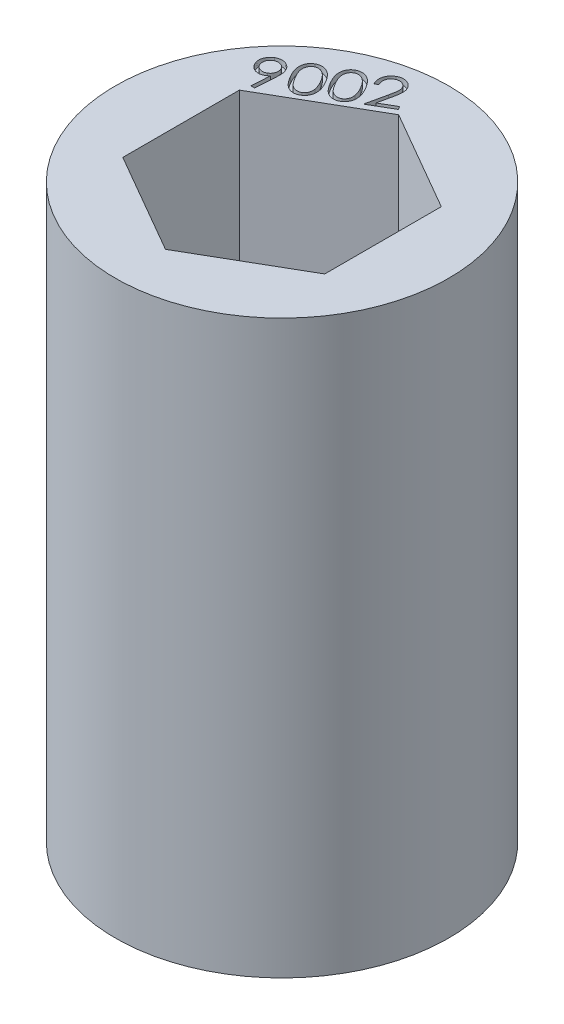
from build123d import *

# Parameters (mm, degrees)
SKETCH1_R           = 11.1125
BOSS_EXTRUDE1_DEPTH = 38.1
CUT_EXTRUDE2_DEPTH  = 0.399999962


with BuildPart() as part:
    # Sketch1 → Boss-Extrude1 (new body)
    with BuildSketch(Plane(origin=(0, 0, 0), x_dir=(1, 0, 0), z_dir=(0, 1, 0))):
        with Locations(Location((0, 0, 0), (0, 0, 90))):
            Circle(SKETCH1_R)
        Polygon((0, 7.772289324), (-6.731, 3.886144662), (-6.731, -3.886144662), (0, -7.772289324), (6.731, -3.886144662), (6.731, 3.886144662), align=None, mode=Mode.SUBTRACT)
    extrude(amount=BOSS_EXTRUDE1_DEPTH)

    # Sketch2 → Cut-Extrude2 (cut)
    # profile 1 of 4: a face of its own
    with BuildSketch(Plane(origin=(0, 38.1, 0), x_dir=(1, 0, 0), z_dir=(0, 1, 0))):
        with BuildLine():
            Line((-6.341689912, 4.509607129), (-6.587447124, 4.520801039))
            Line((-6.587447124, 4.520801039), (-6.519266034, 5.752639982))
            add(Edge.make_bspline(
                [(-6.519266034, 5.752639982), (-6.535115984, 5.735418518), (-6.566015902, 5.701844794), (-6.615639899, 5.657045179), (-6.666054362, 5.61785451), (-6.701391585, 5.595971632), (-6.718721162, 5.585240142)],
                knots=[0, 0, 0, 0, 1.073776942, 2.093358062, 3.064971809, 4, 4, 4, 4], degree=3))
            add(Edge.make_bspline(
                [(-6.718721162, 5.585240142), (-6.740190353, 5.573375298), (-6.782465877, 5.550011934), (-6.849189276, 5.524057141), (-6.916211032, 5.503507865), (-6.98455062, 5.491340301), (-7.053965627, 5.487051616), (-7.124226627, 5.488748908), (-7.195424017, 5.498841339), (-7.266610463, 5.515508184), (-7.336358091, 5.538646903), (-7.402880333, 5.56822068), (-7.465126672, 5.604075006), (-7.523767084, 5.645573763), (-7.578135257, 5.693370767), (-7.628024349, 5.747463271), (-7.675155997, 5.806387374), (-7.701545969, 5.850007485), (-7.714979175, 5.872211296)],
                knots=[0, 0, 0, 0, 1.018133992, 2.004833355, 2.968050456, 3.927392872, 4.880867695, 5.853780567, 6.84244091, 7.862937872, 8.888047547, 9.891218825, 10.882437675, 11.867953537, 12.871644484, 13.88381012, 14.922802359, 16, 16, 16, 16], degree=3))
            add(Edge.make_bspline(
                [(-7.714979175, 5.872211296), (-7.73179642, 5.903352756), (-7.764871178, 5.96459919), (-7.798825331, 6.062258045), (-7.819425921, 6.161302762), (-7.826724862, 6.261443281), (-7.819918124, 6.36137828), (-7.800161746, 6.459919196), (-7.765816335, 6.555877108), (-7.719298363, 6.648398425), (-7.661210331, 6.735125396), (-7.592213175, 6.812993215), (-7.514393665, 6.882230505), (-7.455548697, 6.919124714), (-7.425972765, 6.937668027)],
                knots=[0, 0, 0, 0, 1.034877314, 2.035310589, 3.01406532, 3.989830017, 4.965253495, 5.938145702, 6.922878307, 7.939982544, 8.963286446, 9.969507557, 10.979458936, 12, 12, 12, 12], degree=3))
            add(Edge.make_bspline(
                [(-7.425972765, 6.937668027), (-7.395827361, 6.953777535), (-7.336168034, 6.985659093), (-7.240564481, 7.018366694), (-7.142339109, 7.039367637), (-7.042033508, 7.045951785), (-6.941713756, 7.04093449), (-6.843655248, 7.021144442), (-6.748650534, 6.988498335), (-6.658511171, 6.941881882), (-6.574489532, 6.884741248), (-6.498494408, 6.818216289), (-6.431784176, 6.74236602), (-6.395906772, 6.685484801), (-6.377815714, 6.656802642)],
                knots=[0, 0, 0, 0, 1.017484842, 2.013655614, 3.000286277, 4.003858304, 5.0014266, 5.986034307, 6.975769135, 7.986511211, 9.001795403, 9.997748037, 10.990371328, 12, 12, 12, 12], degree=3))
            add(Edge.make_bspline(
                [(-6.377815714, 6.656802642), (-6.365338732, 6.633609029), (-6.34002248, 6.58654834), (-6.309500106, 6.510518519), (-6.285458846, 6.428987984), (-6.269672772, 6.357169089), (-6.260306184, 6.296014382), (-6.254813982, 6.246272579), (-6.250746715, 6.193155808), (-6.248317285, 6.136650094), (-6.247112881, 6.076583143), (-6.248603321, 6.012975839), (-6.250184504, 5.945940506), (-6.253160652, 5.900188773), (-6.254682701, 5.876790623)],
                knots=[0, 0, 0, 0, 1.182164166, 2.398654368, 3.671095493, 4.996362854, 5.697697926, 6.448887013, 7.243432771, 8.089817077, 8.988794623, 9.941086459, 10.947039495, 12, 12, 12, 12], degree=3))
            Line((-6.254682701, 5.876790623), (-6.341689912, 4.509607129))
        make_face()
        with BuildLine():
            add(Edge.make_bspline(
                [(-6.779270041, 5.805047834), (-6.763794125, 5.81457527), (-6.733396942, 5.833288685), (-6.692006128, 5.866308845), (-6.654677253, 5.90203708), (-6.621172415, 5.940777326), (-6.592941125, 5.983297575), (-6.56806583, 6.028437665), (-6.54791559, 6.076957987), (-6.531606211, 6.12780288), (-6.520757071, 6.180030786), (-6.51373588, 6.23205677), (-6.512647873, 6.283620134), (-6.517623724, 6.334333899), (-6.52637687, 6.384439016), (-6.541618974, 6.433553997), (-6.561328944, 6.482214399), (-6.578312042, 6.513300607), (-6.58693831, 6.529090302)],
                knots=[0, 0, 0, 0, 1.045838798, 2.054195393, 3.042095994, 4.01892461, 4.996924602, 5.976045845, 6.982887395, 8.017767017, 9.046543829, 10.050918556, 11.037659536, 12.008659212, 12.981916231, 13.961475876, 14.964567361, 16, 16, 16, 16], degree=3))
            add(Edge.make_bspline(
                [(-6.58693831, 6.529090302), (-6.596334814, 6.54436384), (-6.614854659, 6.574466904), (-6.646982549, 6.61599525), (-6.683104965, 6.652657042), (-6.721564137, 6.686035178), (-6.763748711, 6.714511996), (-6.808694795, 6.739375257), (-6.85744594, 6.758793889), (-6.908156642, 6.775223598), (-6.960353771, 6.786231316), (-7.012469726, 6.79248455), (-7.064106322, 6.793467553), (-7.115139239, 6.789605745), (-7.165396456, 6.779664), (-7.214919305, 6.764739879), (-7.264110959, 6.745172462), (-7.295216791, 6.727721738), (-7.310980778, 6.718877962)],
                knots=[0, 0, 0, 0, 1.032722608, 2.035423229, 3.016659327, 3.993848871, 4.964125467, 5.943608486, 6.947070603, 7.982332603, 9.011489537, 10.015046801, 11.002152371, 11.982414923, 12.957844117, 13.947123666, 14.959631925, 16, 16, 16, 16], degree=3))
            add(Edge.make_bspline(
                [(-7.310980778, 6.718877962), (-7.326257831, 6.709484312), (-7.356367822, 6.690970091), (-7.397845726, 6.65880125), (-7.434615143, 6.622906892), (-7.467307907, 6.583909991), (-7.496507989, 6.542261904), (-7.5212267, 6.497091614), (-7.54068409, 6.448377059), (-7.557157435, 6.397664161), (-7.567956217, 6.345417855), (-7.574994486, 6.293395482), (-7.576063639, 6.241835461), (-7.571145535, 6.191105122), (-7.562188174, 6.141110667), (-7.547772325, 6.091801068), (-7.527858015, 6.043251572), (-7.510905575, 6.012156257), (-7.50229488, 5.996361937)],
                knots=[0, 0, 0, 0, 1.035054365, 2.040018956, 3.023470561, 3.996529503, 4.97455344, 5.956248008, 6.961975815, 7.999575305, 9.031055945, 10.038070368, 11.027404697, 12.000956352, 12.976771283, 13.956118232, 14.96184604, 16, 16, 16, 16], degree=3))
            add(Edge.make_bspline(
                [(-7.50229488, 5.996361937), (-7.492937473, 5.981056401), (-7.474440062, 5.950800926), (-7.441669883, 5.909660495), (-7.405844485, 5.87270442), (-7.366810186, 5.840041017), (-7.325172138, 5.810833052), (-7.27999913, 5.786116475), (-7.231285328, 5.766658495), (-7.18057222, 5.750185315), (-7.12832597, 5.739386488), (-7.076303583, 5.732348231), (-7.024743566, 5.731279075), (-6.974013226, 5.73619718), (-6.924018771, 5.745154541), (-6.874709172, 5.75957039), (-6.826159676, 5.779484699), (-6.795064361, 5.796437139), (-6.779270041, 5.805047834)],
                knots=[0, 0, 0, 0, 1.03466364, 2.045288747, 3.028369106, 4.001060725, 4.978715465, 5.960039451, 6.965387603, 8.002595407, 9.03368667, 10.040320953, 11.029281816, 12.002465962, 12.97791253, 13.956889783, 14.962237935, 16, 16, 16, 16], degree=3))
        make_face(mode=Mode.SUBTRACT)
    # profile 2 of 4: a face of its own
    with BuildSketch(Plane(origin=(0, 38.1, 0), x_dir=(1, 0, 0), z_dir=(0, 1, 0))):
        with BuildLine():
            add(Edge.make_bspline(
                [(-5.799020566, 6.345917225), (-5.819137188, 6.380876373), (-5.858250299, 6.448848075), (-5.910645372, 6.550183286), (-5.958270431, 6.646218542), (-5.997603154, 6.73878403), (-6.032157009, 6.826197983), (-6.059159785, 6.90972027), (-6.080370238, 6.988434421), (-6.09483277, 7.063459777), (-6.103224739, 7.135088312), (-6.108137585, 7.204202044), (-6.1081872, 7.271196242), (-6.103533868, 7.335949783), (-6.094971925, 7.398561652), (-6.081845729, 7.459001216), (-6.063923561, 7.517358806), (-6.041547615, 7.573315564), (-6.014996094, 7.62653638), (-5.985540414, 7.677225821), (-5.952343061, 7.724702408), (-5.915561443, 7.769078364), (-5.875441839, 7.810512438), (-5.831180746, 7.847970666), (-5.784503006, 7.883596572), (-5.750875737, 7.904190292), (-5.733892361, 7.914591103)],
                knots=[0, 0, 0, 0, 1.644034348, 3.196525615, 4.649901988, 6.012627005, 7.295351775, 8.480442992, 9.588999708, 10.616866424, 11.591961896, 12.527448117, 13.440119844, 14.320422827, 15.172102722, 16.014299769, 16.838828387, 17.657976332, 18.468116412, 19.261441334, 20.045949409, 20.826762069, 21.609073322, 22.393520457, 23.188651129, 24, 24, 24, 24], degree=3))
            add(Edge.make_bspline(
                [(-5.733892361, 7.914591103), (-5.716221156, 7.924356924), (-5.681331282, 7.943638475), (-5.626905383, 7.967719936), (-5.571557767, 7.986946895), (-5.515116783, 8.001928534), (-5.457744686, 8.012051554), (-5.399387254, 8.017477212), (-5.340196324, 8.01933531), (-5.280155523, 8.015462259), (-5.219553032, 8.007503263), (-5.158810677, 7.994154833), (-5.09798996, 7.97559266), (-5.03713486, 7.952453118), (-4.976688223, 7.923363283), (-4.91594775, 7.889951375), (-4.855701501, 7.850401155), (-4.794632702, 7.806660557), (-4.733837412, 7.756480417), (-4.673265298, 7.699437505), (-4.613268743, 7.634781163), (-4.552845555, 7.563770705), (-4.492561335, 7.485495767), (-4.43292518, 7.39997821), (-4.372590227, 7.307821859), (-4.334073595, 7.243105717), (-4.314301014, 7.209883571)],
                knots=[0, 0, 0, 0, 0.817377658, 1.613823418, 2.406706973, 3.188082347, 3.976310968, 4.762981823, 5.560019736, 6.371953555, 7.196686324, 8.033346022, 8.887307745, 9.77003846, 10.667188984, 11.601865034, 12.575431866, 13.583918072, 14.64279311, 15.765256261, 16.950981143, 18.213051169, 19.540207999, 20.950354672, 22.434459175, 24, 24, 24, 24], degree=3))
            add(Edge.make_bspline(
                [(-4.314301014, 7.209883571), (-4.295240754, 7.176430329), (-4.258115995, 7.111271539), (-4.20779242, 7.013981382), (-4.163215626, 6.920249083), (-4.12504704, 6.829747275), (-4.092800298, 6.742694247), (-4.066717504, 6.65915919), (-4.046521515, 6.579017953), (-4.032944904, 6.501940275), (-4.023967393, 6.427876916), (-4.020657471, 6.356302246), (-4.020895335, 6.287145494), (-4.025890541, 6.220294167), (-4.035811943, 6.155930538), (-4.049080998, 6.09363262), (-4.068390976, 6.033966568), (-4.090982838, 5.97650783), (-4.118087988, 5.9219881), (-4.148741033, 5.870601774), (-4.182167952, 5.821983409), (-4.219639316, 5.777039562), (-4.260442582, 5.735150854), (-4.304913833, 5.696453866), (-4.352565061, 5.660645638), (-4.386708692, 5.639915582), (-4.403852296, 5.629506969)],
                knots=[0, 0, 0, 0, 1.560702367, 3.039869158, 4.439270698, 5.7673313, 7.020315304, 8.201179658, 9.313456641, 10.3681399, 11.371931529, 12.335719086, 13.27082701, 14.174152084, 15.05027287, 15.909393739, 16.753106729, 17.589390937, 18.410385714, 19.218115999, 20.013460668, 20.799598541, 21.58726835, 22.381542408, 23.187368323, 24, 24, 24, 24], degree=3))
            add(Edge.make_bspline(
                [(-4.403852296, 5.629506969), (-4.421197894, 5.61994198), (-4.455632749, 5.600953358), (-4.509062761, 5.576856375), (-4.563881229, 5.558206471), (-4.619247185, 5.543298766), (-4.675575106, 5.533010121), (-4.732760111, 5.527647227), (-4.79093337, 5.525783332), (-4.849795318, 5.529622383), (-4.909042093, 5.537625724), (-4.968110356, 5.550904189), (-5.02707859, 5.569494998), (-5.085846855, 5.592929053), (-5.144636451, 5.620895813), (-5.202865421, 5.654464224), (-5.261334613, 5.692411861), (-5.3196715, 5.736223003), (-5.378881117, 5.785535862), (-5.436931924, 5.843759384), (-5.496735751, 5.908126784), (-5.55625515, 5.981010775), (-5.616469619, 6.061268538), (-5.677860438, 6.148878777), (-5.738514045, 6.244756675), (-5.778475934, 6.311568758), (-5.799020566, 6.345917225)],
                knots=[0, 0, 0, 0, 0.808350198, 1.604754265, 2.388541232, 3.169387609, 3.943391085, 4.722486235, 5.51196978, 6.31648673, 7.127145912, 7.950126741, 8.784357439, 9.64825073, 10.530750472, 11.439234062, 12.389715372, 13.374155297, 14.415677566, 15.531832443, 16.727270725, 18.001027435, 19.370379368, 20.822274555, 22.366313522, 24, 24, 24, 24], degree=3))
        make_face()
        with BuildLine():
            add(Edge.make_bspline(
                [(-5.590915598, 6.460909212), (-5.573440634, 6.431298356), (-5.53953556, 6.373847122), (-5.487666865, 6.292139709), (-5.437286703, 6.217016794), (-5.387973694, 6.148734993), (-5.339827588, 6.08723638), (-5.292924494, 6.032446399), (-5.247358097, 5.984576074), (-5.202443283, 5.943145077), (-5.157859735, 5.907401491), (-5.113553727, 5.87575857), (-5.069068725, 5.847810351), (-5.023729969, 5.824710335), (-4.97850677, 5.804609898), (-4.932924943, 5.788698585), (-4.886969778, 5.776899606), (-4.82624751, 5.767039846), (-4.751910517, 5.763271467), (-4.665874847, 5.770999897), (-4.584541831, 5.792505443), (-4.535589993, 5.817861348), (-4.511212072, 5.830488539)],
                knots=[0, 0, 0, 0, 1.476356606, 2.864439632, 4.155202907, 5.359990145, 6.480395206, 7.508129809, 8.455932756, 9.316718945, 10.129977133, 10.908036151, 11.653792312, 12.383442324, 13.091134884, 13.777520252, 14.454059297, 15.125759256, 16.416522531, 17.638359492, 18.823907595, 20, 20, 20, 20], degree=3))
            add(Edge.make_bspline(
                [(-4.511212072, 5.830488539), (-4.488051977, 5.845478927), (-4.441783285, 5.875426368), (-4.382777342, 5.934837304), (-4.333688863, 6.004546303), (-4.30073706, 6.069896442), (-4.280110792, 6.126546004), (-4.267591542, 6.17157471), (-4.259896562, 6.218677856), (-4.254405582, 6.267421904), (-4.253904252, 6.318121821), (-4.25561818, 6.370655638), (-4.261919155, 6.425205022), (-4.26863577, 6.461962018), (-4.272069444, 6.480752962)],
                knots=[0, 0, 0, 0, 1.33630058, 2.669629766, 4.033624605, 5.462390011, 6.207376901, 6.958436539, 7.727338561, 8.522083004, 9.337418894, 10.186163895, 11.072729092, 12, 12, 12, 12], degree=3))
            add(Edge.make_bspline(
                [(-4.272069444, 6.480752962), (-4.276870691, 6.504395205), (-4.286611403, 6.5523603), (-4.306927248, 6.624450766), (-4.331407794, 6.697823803), (-4.359474677, 6.773123359), (-4.391913794, 6.849762377), (-4.429392413, 6.9276101), (-4.470497395, 7.007098846), (-4.500513443, 7.059883529), (-4.515791399, 7.086750559)],
                knots=[0, 0, 0, 0, 0.882068512, 1.78952996, 2.736964178, 3.71053707, 4.727846161, 5.779394579, 6.869727589, 8, 8, 8, 8], degree=3))
            add(Edge.make_bspline(
                [(-4.515791399, 7.086750559), (-4.531554558, 7.113487619), (-4.562275809, 7.165596203), (-4.610362965, 7.240239331), (-4.658679725, 7.309596198), (-4.70614773, 7.374656176), (-4.754924033, 7.433619732), (-4.802978179, 7.488399587), (-4.851852419, 7.537533498), (-4.900339488, 7.582106792), (-4.948482067, 7.621828588), (-4.996711284, 7.656627806), (-5.044356593, 7.687202722), (-5.09186172, 7.713415112), (-5.139169878, 7.734852714), (-5.186350501, 7.751668017), (-5.233014175, 7.764791953), (-5.29405867, 7.774373361), (-5.367840868, 7.778318559), (-5.453084073, 7.770594531), (-5.533390072, 7.748848128), (-5.58195205, 7.723980794), (-5.606180021, 7.711574277)],
                knots=[0, 0, 0, 0, 1.332504437, 2.596954185, 3.810955169, 4.961515238, 6.053335941, 7.095281101, 8.089064306, 9.027099332, 9.922178341, 10.767001951, 11.579054004, 12.351414003, 13.094486943, 13.806213877, 14.500440979, 15.172034041, 16.45531947, 17.662465411, 18.83378471, 20, 20, 20, 20], degree=3))
            add(Edge.make_bspline(
                [(-5.606180021, 7.711574277), (-5.629318361, 7.696385519), (-5.675462065, 7.666095294), (-5.734941089, 7.606503149), (-5.784157605, 7.535941266), (-5.817658757, 7.469865968), (-5.838380991, 7.412468235), (-5.850477095, 7.366799618), (-5.859899509, 7.319605593), (-5.864728874, 7.270545471), (-5.866323846, 7.21987883), (-5.863977204, 7.167391657), (-5.85917225, 7.112959508), (-5.849770369, 7.056348029), (-5.835782259, 6.996712635), (-5.816777154, 6.933234667), (-5.792901384, 6.865141236), (-5.762269328, 6.793280489), (-5.728030741, 6.716003433), (-5.686839449, 6.634939163), (-5.64131469, 6.54894579), (-5.608047455, 6.490834951), (-5.590915598, 6.460909212)],
                knots=[0, 0, 0, 0, 1.185397667, 2.363982905, 3.585758524, 4.864978775, 5.530346258, 6.201263852, 6.890717709, 7.593225447, 8.314118558, 9.064359639, 9.846542981, 10.657816113, 11.524680262, 12.473501023, 13.500195167, 14.619390862, 15.824731198, 17.126732327, 18.520333571, 20, 20, 20, 20], degree=3))
        make_face(mode=Mode.SUBTRACT)
    # profile 3 of 4: a face of its own
    with BuildSketch(Plane(origin=(0, 38.1, 0), x_dir=(1, 0, 0), z_dir=(0, 1, 0))):
        with BuildLine():
            add(Edge.make_bspline(
                [(-4.106940161, 7.322840302), (-4.127056784, 7.35779945), (-4.166169895, 7.425771152), (-4.218564967, 7.527106363), (-4.266190027, 7.623141619), (-4.30552275, 7.715707107), (-4.340076604, 7.80312106), (-4.36707938, 7.886643347), (-4.388289834, 7.965357498), (-4.402752365, 8.040382854), (-4.411144335, 8.112011389), (-4.416057181, 8.181125121), (-4.416106796, 8.248119319), (-4.411453463, 8.312872859), (-4.40289152, 8.375484729), (-4.389765325, 8.435924293), (-4.371843156, 8.494281883), (-4.34946721, 8.550238641), (-4.32291569, 8.603459457), (-4.29346001, 8.654148898), (-4.260262657, 8.701625485), (-4.223481038, 8.746001441), (-4.183361435, 8.787435515), (-4.139100342, 8.824893743), (-4.092422601, 8.860519649), (-4.058795333, 8.881113369), (-4.041811956, 8.89151418)],
                knots=[0, 0, 0, 0, 1.644034348, 3.196525615, 4.649901988, 6.012627005, 7.295351775, 8.480442992, 9.588999708, 10.616866424, 11.591961896, 12.527448117, 13.440119844, 14.320422827, 15.172102722, 16.014299769, 16.838828387, 17.657976332, 18.468116412, 19.261441334, 20.045949409, 20.826762069, 21.609073322, 22.393520457, 23.188651129, 24, 24, 24, 24], degree=3))
            add(Edge.make_bspline(
                [(-4.041811956, 8.89151418), (-4.024140752, 8.901280001), (-3.989250878, 8.920561552), (-3.934824978, 8.944643013), (-3.879477363, 8.963869972), (-3.823036378, 8.978851611), (-3.765664282, 8.988974631), (-3.70730685, 8.994400289), (-3.64811592, 8.996258387), (-3.588075119, 8.992385335), (-3.527472628, 8.98442634), (-3.466730273, 8.97107791), (-3.405909555, 8.952515737), (-3.345054456, 8.929376195), (-3.284607819, 8.90028636), (-3.223867345, 8.866874452), (-3.163621097, 8.827324232), (-3.102552297, 8.783583634), (-3.041757008, 8.733403494), (-2.981184893, 8.676360582), (-2.921188339, 8.61170424), (-2.860765151, 8.540693782), (-2.800480931, 8.462418844), (-2.740844776, 8.376901287), (-2.680509823, 8.284744936), (-2.641993191, 8.220028794), (-2.62222061, 8.186806648)],
                knots=[0, 0, 0, 0, 0.817377658, 1.613823418, 2.406706973, 3.188082347, 3.976310968, 4.762981823, 5.560019736, 6.371953555, 7.196686324, 8.033346022, 8.887307745, 9.77003846, 10.667188984, 11.601865034, 12.575431866, 13.583918072, 14.64279311, 15.765256261, 16.950981143, 18.213051169, 19.540207999, 20.950354672, 22.434459175, 24, 24, 24, 24], degree=3))
            add(Edge.make_bspline(
                [(-2.62222061, 8.186806648), (-2.603160349, 8.153353406), (-2.56603559, 8.088194616), (-2.515712016, 7.990904459), (-2.471135222, 7.89717216), (-2.432966636, 7.806670352), (-2.400719893, 7.719617324), (-2.374637099, 7.636082267), (-2.354441111, 7.55594103), (-2.3408645, 7.478863352), (-2.331886989, 7.404799993), (-2.328577067, 7.333225323), (-2.32881493, 7.264068571), (-2.333810136, 7.197217244), (-2.343731539, 7.132853615), (-2.357000594, 7.070555697), (-2.376310571, 7.010889645), (-2.398902433, 6.953430907), (-2.426007584, 6.898911177), (-2.456660628, 6.847524851), (-2.490087548, 6.798906486), (-2.527558911, 6.753962639), (-2.568362177, 6.71207393), (-2.612833429, 6.673376942), (-2.660484657, 6.637568715), (-2.694628288, 6.616838659), (-2.711771892, 6.606430046)],
                knots=[0, 0, 0, 0, 1.560702367, 3.039869158, 4.439270698, 5.7673313, 7.020315304, 8.201179658, 9.313456641, 10.3681399, 11.371931529, 12.335719086, 13.27082701, 14.174152084, 15.05027287, 15.909393739, 16.753106729, 17.589390937, 18.410385714, 19.218115999, 20.013460668, 20.799598541, 21.58726835, 22.381542408, 23.187368323, 24, 24, 24, 24], degree=3))
            add(Edge.make_bspline(
                [(-2.711771892, 6.606430046), (-2.72911749, 6.596865057), (-2.763552344, 6.577876435), (-2.816982357, 6.553779452), (-2.871800825, 6.535129548), (-2.927166781, 6.520221843), (-2.983494701, 6.509933198), (-3.040679707, 6.504570304), (-3.098852965, 6.502706409), (-3.157714914, 6.50654546), (-3.216961689, 6.514548801), (-3.276029951, 6.527827266), (-3.334998186, 6.546418074), (-3.39376645, 6.569852129), (-3.452556046, 6.59781889), (-3.510785017, 6.631387301), (-3.569254208, 6.669334938), (-3.627591096, 6.71314608), (-3.686800712, 6.762458939), (-3.74485152, 6.820682461), (-3.804655347, 6.885049861), (-3.864174746, 6.957933852), (-3.924389214, 7.038191615), (-3.985780033, 7.125801854), (-4.046433641, 7.221679752), (-4.08639553, 7.288491835), (-4.106940161, 7.322840302)],
                knots=[0, 0, 0, 0, 0.808350198, 1.604754265, 2.388541232, 3.169387609, 3.943391085, 4.722486235, 5.51196978, 6.31648673, 7.127145912, 7.950126741, 8.784357439, 9.64825073, 10.530750472, 11.439234062, 12.389715372, 13.374155297, 14.415677566, 15.531832443, 16.727270725, 18.001027435, 19.370379368, 20.822274555, 22.366313522, 24, 24, 24, 24], degree=3))
        make_face()
        with BuildLine():
            add(Edge.make_bspline(
                [(-3.898835193, 7.437832289), (-3.88136023, 7.408221433), (-3.847455156, 7.350770199), (-3.795586461, 7.269062786), (-3.745206299, 7.193939871), (-3.69589329, 7.125658069), (-3.647747184, 7.064159457), (-3.60084409, 7.009369476), (-3.555277693, 6.961499151), (-3.510362879, 6.920068154), (-3.465779331, 6.884324568), (-3.421473322, 6.852681647), (-3.37698832, 6.824733428), (-3.331649565, 6.801633412), (-3.286426366, 6.781532974), (-3.240844539, 6.765621662), (-3.194889374, 6.753822683), (-3.134167106, 6.743962923), (-3.059830112, 6.740194544), (-2.973794442, 6.747922974), (-2.892461427, 6.76942852), (-2.843509589, 6.794784425), (-2.819131668, 6.807411616)],
                knots=[0, 0, 0, 0, 1.476356606, 2.864439632, 4.155202907, 5.359990145, 6.480395206, 7.508129809, 8.455932756, 9.316718945, 10.129977133, 10.908036151, 11.653792312, 12.383442324, 13.091134884, 13.777520252, 14.454059297, 15.125759256, 16.416522531, 17.638359492, 18.823907595, 20, 20, 20, 20], degree=3))
            add(Edge.make_bspline(
                [(-2.819131668, 6.807411616), (-2.795971572, 6.822402003), (-2.74970288, 6.852349445), (-2.690696938, 6.911760381), (-2.641608458, 6.98146938), (-2.608656656, 7.046819519), (-2.588030388, 7.10346908), (-2.575511138, 7.148497787), (-2.567816158, 7.195600933), (-2.562325177, 7.244344981), (-2.561823847, 7.295044898), (-2.563537776, 7.347578715), (-2.569838751, 7.402128099), (-2.576555366, 7.438885095), (-2.57998904, 7.457676039)],
                knots=[0, 0, 0, 0, 1.33630058, 2.669629766, 4.033624605, 5.462390011, 6.207376901, 6.958436539, 7.727338561, 8.522083004, 9.337418894, 10.186163895, 11.072729092, 12, 12, 12, 12], degree=3))
            add(Edge.make_bspline(
                [(-2.57998904, 7.457676039), (-2.584790287, 7.481318281), (-2.594530999, 7.529283377), (-2.614846844, 7.601373843), (-2.63932739, 7.67474688), (-2.667394272, 7.750046436), (-2.69983339, 7.826685454), (-2.737312009, 7.904533177), (-2.778416991, 7.984021923), (-2.808433039, 8.036806606), (-2.823710995, 8.063673635)],
                knots=[0, 0, 0, 0, 0.882068512, 1.78952996, 2.736964178, 3.71053707, 4.727846161, 5.779394579, 6.869727589, 8, 8, 8, 8], degree=3))
            add(Edge.make_bspline(
                [(-2.823710995, 8.063673635), (-2.839474154, 8.090410696), (-2.870195405, 8.14251928), (-2.91828256, 8.217162408), (-2.96659932, 8.286519275), (-3.014067326, 8.351579253), (-3.062843628, 8.410542809), (-3.110897775, 8.465322664), (-3.159772015, 8.514456575), (-3.208259084, 8.559029869), (-3.256401663, 8.598751665), (-3.30463088, 8.633550883), (-3.352276189, 8.664125799), (-3.399781315, 8.690338189), (-3.447089473, 8.711775791), (-3.494270097, 8.728591093), (-3.540933771, 8.74171503), (-3.601978265, 8.751296438), (-3.675760464, 8.755241636), (-3.761003668, 8.747517608), (-3.841309668, 8.725771205), (-3.889871645, 8.700903871), (-3.914099617, 8.688497353)],
                knots=[0, 0, 0, 0, 1.332504437, 2.596954185, 3.810955169, 4.961515238, 6.053335941, 7.095281101, 8.089064306, 9.027099332, 9.922178341, 10.767001951, 11.579054004, 12.351414003, 13.094486943, 13.806213877, 14.500440979, 15.172034041, 16.45531947, 17.662465411, 18.83378471, 20, 20, 20, 20], degree=3))
            add(Edge.make_bspline(
                [(-3.914099617, 8.688497353), (-3.937237956, 8.673308596), (-3.983381661, 8.643018371), (-4.042860685, 8.583426226), (-4.092077201, 8.512864343), (-4.125578353, 8.446789045), (-4.146300587, 8.389391312), (-4.15839669, 8.343722695), (-4.167819105, 8.29652867), (-4.172648469, 8.247468547), (-4.174243442, 8.196801907), (-4.1718968, 8.144314734), (-4.167091846, 8.089882585), (-4.157689965, 8.033271106), (-4.143701855, 7.973635712), (-4.12469675, 7.910157744), (-4.10082098, 7.842064313), (-4.070188924, 7.770203566), (-4.035950337, 7.69292651), (-3.994759045, 7.61186224), (-3.949234285, 7.525868867), (-3.91596705, 7.467758028), (-3.898835193, 7.437832289)],
                knots=[0, 0, 0, 0, 1.185397667, 2.363982905, 3.585758524, 4.864978775, 5.530346258, 6.201263852, 6.890717709, 7.593225447, 8.314118558, 9.064359639, 9.846542981, 10.657816113, 11.524680262, 12.473501023, 13.500195167, 14.619390862, 15.824731198, 17.126732327, 18.520333571, 20, 20, 20, 20], degree=3))
        make_face(mode=Mode.SUBTRACT)
    # profile 4 of 4: a face of its own
    with BuildSketch(Plane(origin=(0, 38.1, 0), x_dir=(1, 0, 0), z_dir=(0, 1, 0))):
        with BuildLine():
            Line((-2.397051263, 8.854370751), (-2.605665046, 8.73276418))
            add(Edge.make_bspline(
                [(-2.605665046, 8.73276418), (-2.619773581, 8.759822037), (-2.647449699, 8.812900294), (-2.679103762, 8.895499211), (-2.704180737, 8.97747805), (-2.719800356, 9.059883223), (-2.727812275, 9.142013422), (-2.726352289, 9.224159076), (-2.718023881, 9.306364281), (-2.700586594, 9.387778389), (-2.675772294, 9.46677674), (-2.644258741, 9.542097908), (-2.605470414, 9.612500857), (-2.55980448, 9.678029801), (-2.50764662, 9.739076074), (-2.448191687, 9.794958046), (-2.382579738, 9.846899023), (-2.334455218, 9.876379777), (-2.310044052, 9.891333892)],
                knots=[0, 0, 0, 0, 1.09857967, 2.155037389, 3.18164892, 4.183538712, 5.17161799, 6.149402319, 7.138690165, 8.144207207, 9.143391276, 10.118288091, 11.080986052, 12.033643957, 12.991383783, 13.968251152, 14.969395268, 16, 16, 16, 16], degree=3))
            add(Edge.make_bspline(
                [(-2.310044052, 9.891333892), (-2.285357344, 9.905056479), (-2.236866636, 9.932010982), (-2.161350967, 9.963264503), (-2.086155462, 9.987128904), (-2.010948118, 10.002456393), (-1.935718719, 10.009906605), (-1.860658587, 10.008016401), (-1.785596507, 9.998955344), (-1.711590586, 9.98148435), (-1.639490885, 9.957805933), (-1.571425438, 9.927788656), (-1.507716791, 9.892375829), (-1.44846795, 9.851820103), (-1.394245939, 9.804893614), (-1.34416519, 9.753057138), (-1.299047914, 9.695056206), (-1.273046588, 9.653119992), (-1.259851744, 9.6318387)],
                knots=[0, 0, 0, 0, 1.121392308, 2.20268762, 3.240635821, 4.251634692, 5.246697778, 6.237484838, 7.228775918, 8.245507695, 9.253447697, 10.240078281, 11.196324993, 12.145876335, 13.087286972, 14.040465848, 15.005598836, 16, 16, 16, 16], degree=3))
            add(Edge.make_bspline(
                [(-1.259851744, 9.6318387), (-1.243299903, 9.600828729), (-1.210439095, 9.539263816), (-1.175025696, 9.440597793), (-1.153949868, 9.337967976), (-1.146313195, 9.249363654), (-1.146370938, 9.174025152), (-1.150188325, 9.11070796), (-1.157174411, 9.040689646), (-1.165807465, 8.964025744), (-1.179770541, 8.881072552), (-1.195396735, 8.791293065), (-1.214042059, 8.694860759), (-1.228816226, 8.628591359), (-1.236446296, 8.594366744)],
                knots=[0, 0, 0, 0, 1.187056235, 2.356694088, 3.528283222, 4.719471485, 5.355823275, 6.07355842, 6.862493646, 7.734290229, 8.680565951, 9.705088097, 10.814800252, 12, 12, 12, 12], degree=3))
            Line((-1.236446296, 8.594366744), (-1.437427866, 7.694783411))
            Line((-1.437427866, 7.694783411), (-0.433028828, 8.279410815))
            Line((-0.433028828, 8.279410815), (-0.310913443, 8.069270591))
            Line((-0.310913443, 8.069270591), (-1.788509597, 7.209374757))
            Line((-1.788509597, 7.209374757), (-1.479659437, 8.590805046))
            add(Edge.make_bspline(
                [(-1.479659437, 8.590805046), (-1.47210542, 8.624366439), (-1.457590531, 8.688853978), (-1.438163072, 8.781963636), (-1.422083454, 8.867519375), (-1.407811069, 8.945241954), (-1.398016777, 9.015584958), (-1.389738565, 9.078263246), (-1.385931553, 9.13349035), (-1.383462804, 9.196316016), (-1.387654598, 9.26856991), (-1.403570753, 9.3511616), (-1.429746948, 9.43031114), (-1.455552832, 9.479169767), (-1.468465526, 9.503617546)],
                knots=[0, 0, 0, 0, 1.323237142, 2.54257338, 3.658289289, 4.671864967, 5.581565282, 6.389946672, 7.102961589, 7.709997424, 8.807948104, 9.877584882, 10.937990319, 12, 12, 12, 12], degree=3))
            add(Edge.make_bspline(
                [(-1.468465526, 9.503617546), (-1.477651448, 9.51841895), (-1.495811971, 9.547681254), (-1.528200028, 9.587370471), (-1.563611022, 9.623119563), (-1.601518473, 9.655682485), (-1.644041393, 9.682535939), (-1.689255822, 9.706035748), (-1.737998916, 9.725475167), (-1.789472096, 9.740438438), (-1.842205592, 9.751298324), (-1.895244455, 9.756118324), (-1.94754643, 9.757021157), (-1.999588047, 9.751778246), (-2.051008609, 9.740941742), (-2.101961162, 9.725158004), (-2.15235831, 9.704106178), (-2.18468026, 9.68657121), (-2.201157834, 9.677631969)],
                knots=[0, 0, 0, 0, 0.998051491, 1.973142976, 2.929034396, 3.881605449, 4.831143382, 5.805458597, 6.800520553, 7.834504026, 8.875870259, 9.882273396, 10.884013855, 11.871059453, 12.87430941, 13.892484837, 14.925598974, 16, 16, 16, 16], degree=3))
            add(Edge.make_bspline(
                [(-2.201157834, 9.677631969), (-2.218018817, 9.667292602), (-2.251063834, 9.647028981), (-2.295799872, 9.611208646), (-2.337080626, 9.573858145), (-2.372788485, 9.532390765), (-2.403358508, 9.487611836), (-2.430163328, 9.44034697), (-2.45138284, 9.389515522), (-2.468322623, 9.336297492), (-2.479443975, 9.280664611), (-2.484965567, 9.223574399), (-2.485155165, 9.165082082), (-2.478451094, 9.10541471), (-2.467809774, 9.04406805), (-2.449103472, 8.981986137), (-2.426647299, 8.917924956), (-2.407090099, 8.875928037), (-2.397051263, 8.854370751)],
                knots=[0, 0, 0, 0, 1.006809889, 1.973197595, 2.914967141, 3.84013557, 4.753442375, 5.674241435, 6.60359799, 7.554757452, 8.515720324, 9.488270788, 10.473448095, 11.489855303, 12.54416786, 13.641009271, 14.78911505, 16, 16, 16, 16], degree=3))
        make_face()
    extrude(amount=-CUT_EXTRUDE2_DEPTH, mode=Mode.SUBTRACT)


solid = part.part
